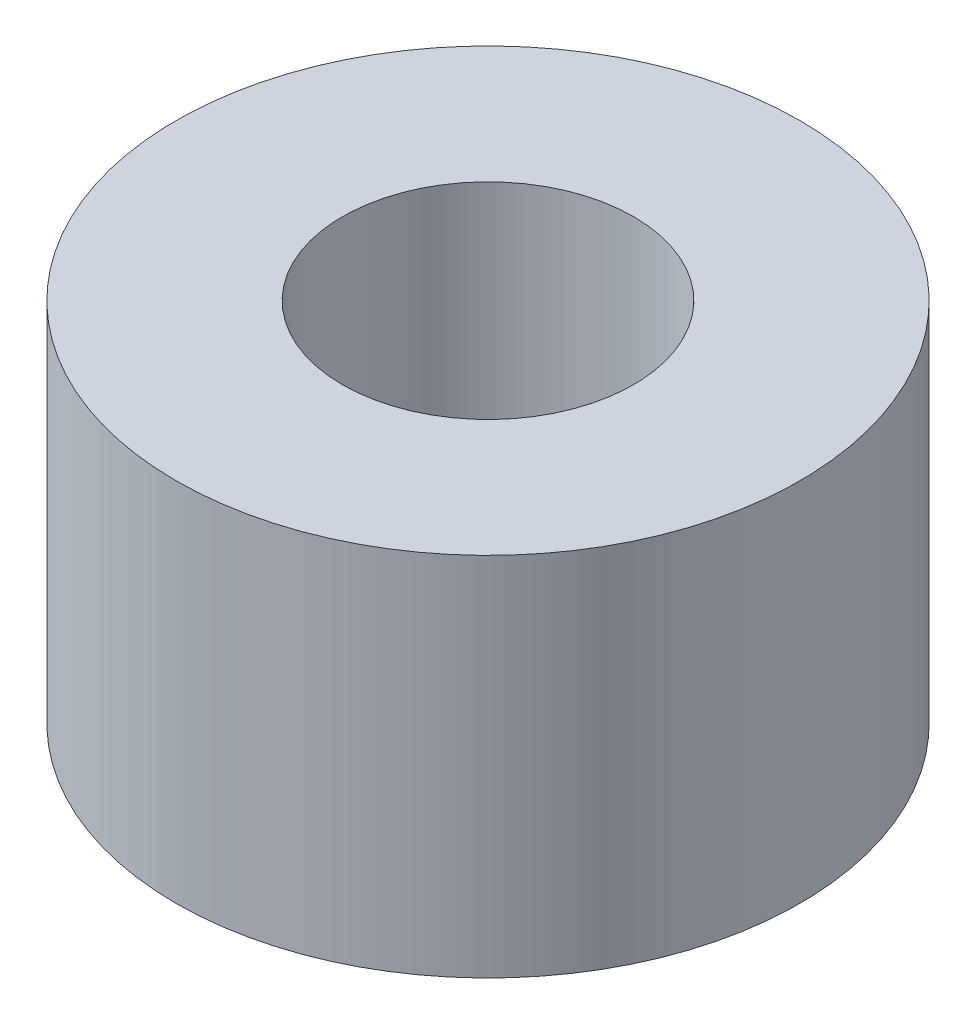
from build123d import *

# Parameters (mm, degrees)
SKETCH1_R           = 3.75
SKETCH1_R_2         = 1.75
BOSS_EXTRUDE1_DEPTH = 4.4


with BuildPart() as part:
    # Sketch1 → Boss-Extrude1 (new body)
    with BuildSketch(Plane(origin=(0, 0, 0), x_dir=(1, 0, 0), z_dir=(0, 1, 0))):
        with Locations(Location((0, 0, 0), (0, 0, 270))):
            Circle(SKETCH1_R)
        with Locations(Location((0, 0, 0), (0, 0, 270))):
            Circle(SKETCH1_R_2, mode=Mode.SUBTRACT)
    extrude(amount=BOSS_EXTRUDE1_DEPTH)


solid = part.part
